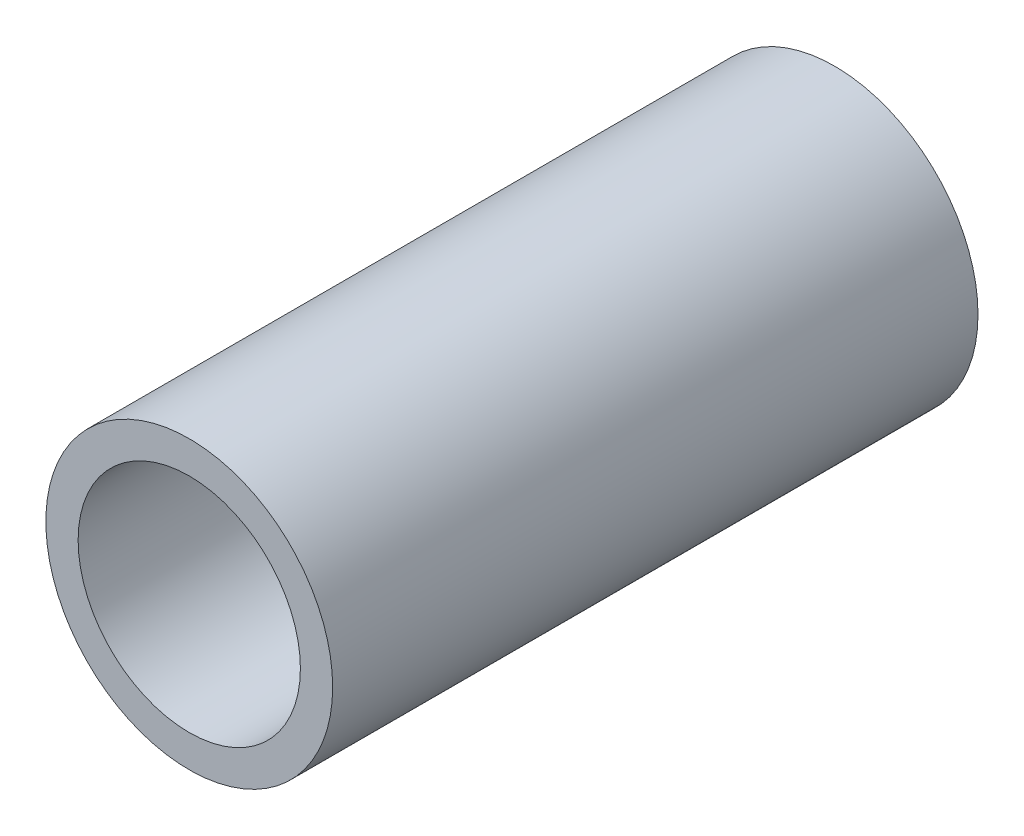
from build123d import *

# Parameters (mm, degrees)
SKETCH_1_R      = 1
SKETCH_1_R_2    = 0.775
EXTRUDE_1_DEPTH = 4.5


with BuildPart() as part:
    # Эскиз1 → Бобышка-Вытянуть1 (new body)
    with BuildSketch(Plane.XY):
        Circle(SKETCH_1_R)
        Circle(SKETCH_1_R_2, mode=Mode.SUBTRACT)
    extrude(amount=EXTRUDE_1_DEPTH)


solid = part.part
